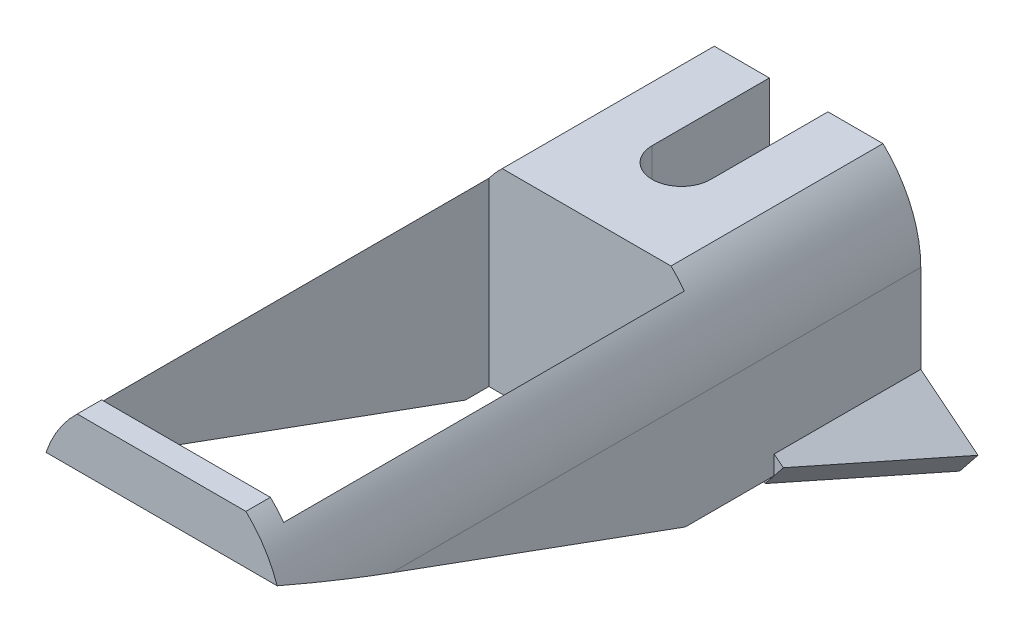
from build123d import *

# Parameters (mm, degrees)
CROQUIS1_W              = 25
CROQUIS1_H              = 20
SALIENTE_EXTRUIR1_DEPTH = 21.7
CROQUIS2_W              = 2.5
CROQUIS2_H              = 20
SALIENTE_EXTRUIR2_DEPTH = 43.5
CROQUIS3_W              = 25
CROQUIS3_H              = 20
SALIENTE_EXTRUIR3_DEPTH = 2.5
CROQUIS4_R              = 2.25
CORTAR_EXTRUIR1_DEPTH   = 10
CROQUIS6_R              = 2
CORTAR_EXTRUIR2_DEPTH   = 10
CORTAR_EXTRUIR4_DEPTH   = 70
SALIENTE_EXTRUIR5_DEPTH = 15
CORTAR_EXTRUIR5_DEPTH   = 15
CORTAR_EXTRUIR6_DEPTH   = 20
CORTAR_EXTRUIR7_START   = -65.2
CORTAR_EXTRUIR7_DEPTH   = 65.2


with BuildPart() as part:
    # Croquis1 → Saliente-Extruir1 (new body)
    with BuildSketch(Plane.XY):
        with Locations((12.5, 10)):
            Rectangle(CROQUIS1_W, CROQUIS1_H)
    extrude(amount=SALIENTE_EXTRUIR1_DEPTH)

    # Croquis2 → Saliente-Extruir2 (add)
    with BuildSketch(Plane.XY.offset(21.7)):
        with Locations((1.25, 10)):
            Rectangle(CROQUIS2_W, CROQUIS2_H)
        with Locations((23.75, 10)):
            Rectangle(CROQUIS2_W, CROQUIS2_H)
    extrude(amount=SALIENTE_EXTRUIR2_DEPTH)

    # Croquis3 → Saliente-Extruir3 (add)
    with BuildSketch(Plane.XY.offset(65.2)):
        with Locations((12.5, 10)):
            Rectangle(CROQUIS3_W, CROQUIS3_H)
    extrude(amount=-SALIENTE_EXTRUIR3_DEPTH)

    # Croquis4 → Cortar-Extruir1 (cut)
    with BuildSketch(Plane.XZ):
        with Locations(Location((7, 18.2, 0), (0, 0, 270))):
            Circle(CROQUIS4_R)
        with Locations(Location((18, 18.2, 0), (0, 0, 270))):
            Circle(CROQUIS4_R)
    extrude(amount=-CORTAR_EXTRUIR1_DEPTH, mode=Mode.SUBTRACT)

    # Croquis6 → Cortar-Extruir2 (cut)
    with BuildSketch(Plane(origin=(0, 0, 0), x_dir=(-1, 0, 0), z_dir=(0, 0, -1))):
        with Locations((-2.5, 5)):
            Circle(CROQUIS6_R)
        with Locations((-22.5, 5)):
            Circle(CROQUIS6_R)
    extrude(amount=-CORTAR_EXTRUIR2_DEPTH, mode=Mode.SUBTRACT)

    # Croquis10 → Cortar-Extruir4 (cut)
    with BuildSketch(Plane(origin=(25, 0, 0), x_dir=(0, 0, -1), z_dir=(1, 0, 0))):
        Polygon((-65.2, 0), (-24.1, 0), (-65.2, 15), align=None)
    extrude(amount=-CORTAR_EXTRUIR4_DEPTH, mode=Mode.SUBTRACT)

    # Croquis11 → Saliente-Extruir5 (add)
    with BuildSketch(Plane(origin=(0, 0, 0), x_dir=(-1, 0, 0), z_dir=(0, 0, -1))):
        Polygon((-25, 1.920937271), (-30.856516071, -2.764275585), (-28.982430928, -5.106882014), (-23.125914857, -0.421669157), (-21.632203551, 0.773299888), align=None)
    saliente_extruir5 = extrude(amount=-SALIENTE_EXTRUIR5_DEPTH)

    # Croquis12 → Cortar-Extruir5 (cut)
    with BuildSketch(Plane(origin=(8.81905499, 11.023818737, 0), x_dir=(0.7808688094430302, -0.6246950475544245, 0), z_dir=(-0.6246950475544245, -0.7808688094430302, 0))):
        Polygon((19.521720236, 15), (25.821720236, 0), (25.821720236, 15), align=None)
    cortar_extruir5 = extrude(amount=-CORTAR_EXTRUIR5_DEPTH, mode=Mode.SUBTRACT)

    # Simetría1: Saliente-Extruir5, Cortar-Extruir5 across plane
    add(saliente_extruir5.mirror(Plane(origin=(12.5, 0, 0), x_dir=(0, 0, 1), z_dir=(1, 0, 0))))
    add(cortar_extruir5.mirror(Plane(origin=(12.5, 0, 0), x_dir=(0, 0, 1), z_dir=(1, 0, 0))), mode=Mode.SUBTRACT)

    # Croquis13 → Cortar-Extruir6 (cut)
    with BuildSketch(Plane.XZ):
        with BuildLine():
            Line((9.5, -11.99123488), (9.5, 11.99123488))
            ThreePointArc((9.5, 11.99123488), (12.5, 14.99123488), (15.5, 11.99123488))
            Line((15.5, 11.99123488), (15.5, -11.99123488))
            ThreePointArc((15.5, -11.99123488), (12.5, -14.99123488), (9.5, -11.99123488))
        make_face()
    extrude(amount=-CORTAR_EXTRUIR6_DEPTH, mode=Mode.SUBTRACT)

    # Croquis14 → Cortar-Extruir7 (cut)
    with BuildSketch(Plane(origin=(0, 0, 0), x_dir=(-1, 0, 0), z_dir=(0, 0, -1)).offset(CORTAR_EXTRUIR7_START)):
        with BuildLine():
            Line((-25, 10.960468636), (-27.59046433, 24.120971106))
            Line((-27.59046433, 24.120971106), (2.993644675, 24.120971106))
            Line((2.993644675, 24.120971106), (0, 10.960468636))
            ThreePointArc((0, 10.960468636), (-12.5, 23.460468636), (-25, 10.960468636))
        make_face()
    extrude(amount=CORTAR_EXTRUIR7_DEPTH, mode=Mode.SUBTRACT)


solid = part.part
